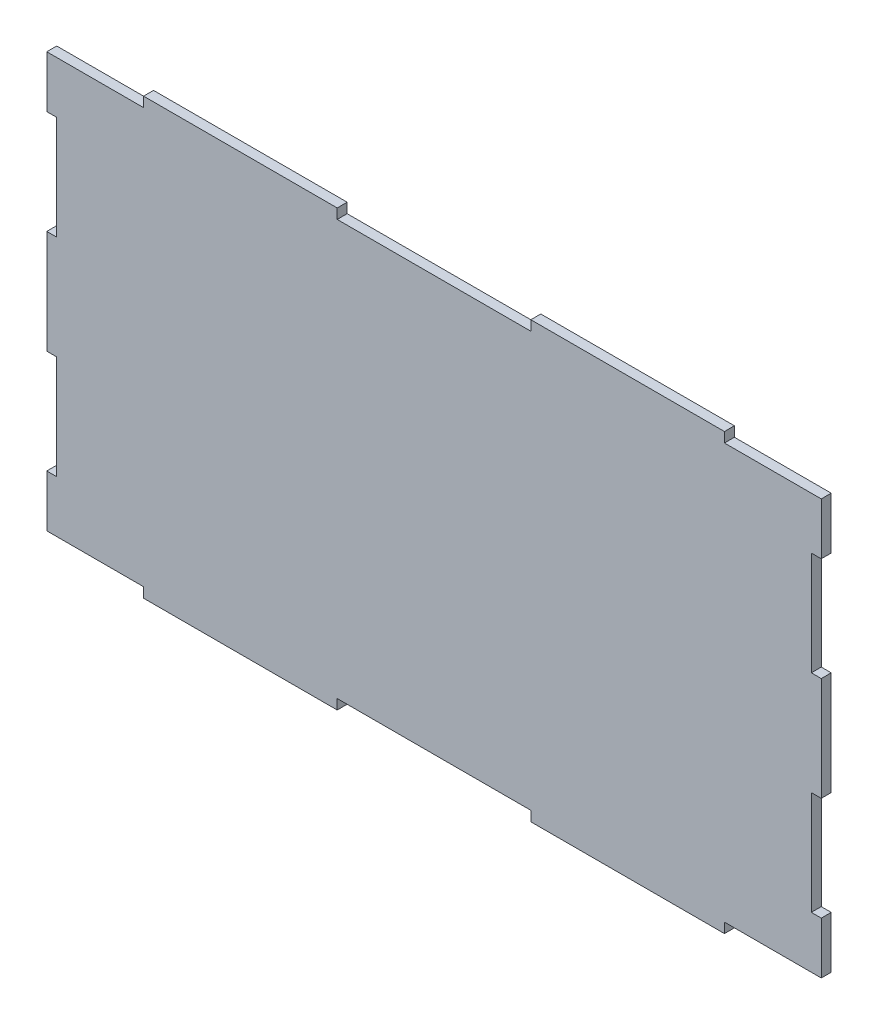
from build123d import *

# Parameters (mm, degrees)
EXTRUDE_1_DEPTH = 3.6


with BuildPart() as part:
    # 草图1 → 凸台-拉伸1 (new body)
    with BuildSketch(Plane.XY):
        Polygon((140, -75), (105, -75), (105, -78.6), (35, -78.6), (35, -75), (-35, -75), (-35, -78.6), (-105, -78.6), (-105, -75), (-140, -75), (-140, -56.25), (-136.4, -56.25), (-136.4, -18.75), (-140, -18.75), (-140, 18.75), (-136.4, 18.75), (-136.4, 56.25), (-140, 56.25), (-140, 75), (-105, 75), (-105, 78.6), (-35, 78.6), (-35, 75), (35, 75), (35, 78.6), (105, 78.6), (105, 75), (140, 75), (140, 56.25), (136.4, 56.25), (136.4, 18.75), (140, 18.75), (140, -18.75), (136.4, -18.75), (136.4, -56.25), (140, -56.25), align=None)
    extrude(amount=EXTRUDE_1_DEPTH)


solid = part.part
